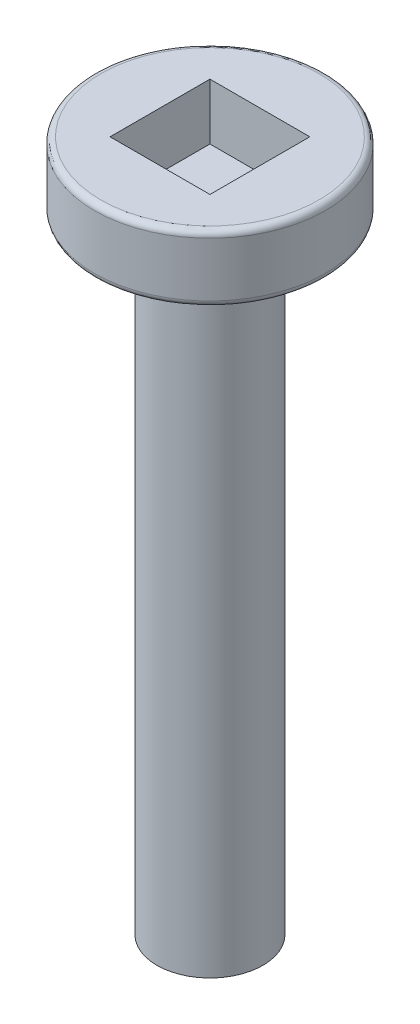
from build123d import *

# Parameters (mm, degrees)
SKETCH1_R           = 4.699
BOSS_EXTRUDE1_DEPTH = 2.7178
SKETCH2_R           = 2.159
BOSS_EXTRUDE2_DEPTH = 28.1178
SKETCH3_W           = 4.064
SKETCH3_H           = 4.064
CUT_EXTRUDE1_DEPTH  = 2.286
FILLET2_R           = 0.254


with BuildPart() as part:
    # Sketch1 → Boss-Extrude1 (new body)
    with BuildSketch(Plane(origin=(0, 0, 0), x_dir=(1, 0, 0), z_dir=(0, 1, 0))):
        with Locations(Location((0, 0, 0), (0, 0, 270))):
            Circle(SKETCH1_R)
    extrude(amount=-BOSS_EXTRUDE1_DEPTH)

    # Sketch2 → Boss-Extrude2 (add)
    with BuildSketch(Plane(origin=(0, 0, 0), x_dir=(1, 0, 0), z_dir=(0, 1, 0))):
        with Locations(Location((0, 0, 0), (0, 0, 270))):
            Circle(SKETCH2_R)
    extrude(amount=-BOSS_EXTRUDE2_DEPTH)

    # Sketch3 → Cut-Extrude1 (cut)
    with BuildSketch(Plane(origin=(0, 0, 0), x_dir=(1, 0, 0), z_dir=(0, 1, 0))):
        Rectangle(SKETCH3_W, SKETCH3_H)
    extrude(amount=-CUT_EXTRUDE1_DEPTH, mode=Mode.SUBTRACT)

    # Fillet2
    fillet2_edges = [part.edges().sort_by_distance(p)[0] for p in [
        (0, 0, -4.699),
        (0, -2.7178, -4.699),
    ]]
    fillet(fillet2_edges, radius=FILLET2_R)


solid = part.part
